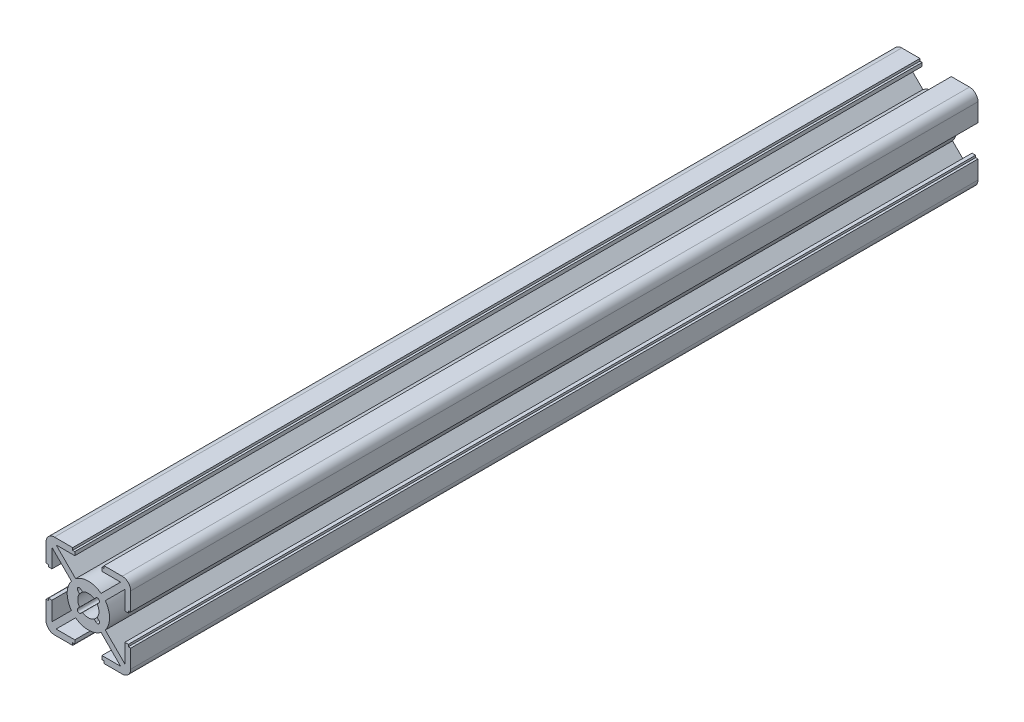
from build123d import *

# Parameters (mm, degrees)
Y_KSEKLIK_EKSTR_ZYON1_DEPTH = 200


with BuildPart() as part:
    # Çizim1 → Yükseklik-Ekstrüzyon1 (new body)
    with BuildSketch(Plane.XY):
        with BuildLine():
            Line((8.6, 7.610050506), (8.6, 3.2))
            Line((8.6, 3.2), (9.44, 3.2))
            Line((9.44, 3.2), (9.44, 3.7))
            Line((9.44, 3.7), (10, 3.7))
            Line((10, 3.7), (10, 8))
            ThreePointArc((10, 8), (9.414213562, 9.414213562), (8, 10))
            Line((8, 10), (3.7, 10))
            Line((3.7, 10), (3.7, 9.44))
            Line((3.7, 9.44), (3.2, 9.44))
            Line((3.2, 9.44), (3.2, 8.6))
            Line((3.2, 8.6), (7.610050506, 8.6))
            Line((7.610050506, 8.6), (3.005739466, 3.99568896))
            ThreePointArc((3.005739466, 3.99568896), (0, 5), (-3.005739466, 3.99568896))
            Line((-3.005739466, 3.99568896), (-7.610050506, 8.6))
            Line((-7.610050506, 8.6), (-3.2, 8.6))
            Line((-3.2, 8.6), (-3.2, 9.44))
            Line((-3.2, 9.44), (-3.7, 9.44))
            Line((-3.7, 9.44), (-3.7, 10))
            Line((-3.7, 10), (-8, 10))
            ThreePointArc((-8, 10), (-9.414213562, 9.414213562), (-10, 8))
            Line((-10, 8), (-10, 3.7))
            Line((-10, 3.7), (-9.44, 3.7))
            Line((-9.44, 3.7), (-9.44, 3.2))
            Line((-9.44, 3.2), (-8.6, 3.2))
            Line((-8.6, 3.2), (-8.6, 7.610050506))
            Line((-8.6, 7.610050506), (-3.99568896, 3.005739466))
            ThreePointArc((-3.99568896, 3.005739466), (-5, 0), (-3.99568896, -3.005739466))
            Line((-3.99568896, -3.005739466), (-8.6, -7.610050506))
            Line((-8.6, -7.610050506), (-8.6, -3.2))
            Line((-8.6, -3.2), (-9.44, -3.2))
            Line((-9.44, -3.2), (-9.44, -3.7))
            Line((-9.44, -3.7), (-10, -3.7))
            Line((-10, -3.7), (-10, -8))
            ThreePointArc((-10, -8), (-9.414213562, -9.414213562), (-8, -10))
            Line((-8, -10), (-3.7, -10))
            Line((-3.7, -10), (-3.7, -9.44))
            Line((-3.7, -9.44), (-3.2, -9.44))
            Line((-3.2, -9.44), (-3.2, -8.6))
            Line((-3.2, -8.6), (-7.610050506, -8.6))
            Line((-7.610050506, -8.6), (-3.005739466, -3.99568896))
            ThreePointArc((-3.005739466, -3.99568896), (0, -5), (3.005739466, -3.99568896))
            Line((3.005739466, -3.99568896), (7.610050506, -8.6))
            Line((7.610050506, -8.6), (3.2, -8.6))
            Line((3.2, -8.6), (3.2, -9.44))
            Line((3.2, -9.44), (3.7, -9.44))
            Line((3.7, -9.44), (3.7, -10))
            Line((3.7, -10), (8, -10))
            ThreePointArc((8, -10), (9.414213562, -9.414213562), (10, -8))
            Line((10, -8), (10, -3.7))
            Line((10, -3.7), (9.44, -3.7))
            Line((9.44, -3.7), (9.44, -3.2))
            Line((9.44, -3.2), (8.6, -3.2))
            Line((8.6, -3.2), (8.6, -7.610050506))
            Line((8.6, -7.610050506), (3.99568896, -3.005739466))
            ThreePointArc((3.99568896, -3.005739466), (5, 0), (3.99568896, 3.005739466))
            Line((3.99568896, 3.005739466), (8.6, 7.610050506))
        make_face()
        with BuildLine():
            Line((2.474873734, 1.767766953), (2.085604198, 1.378497417))
            ThreePointArc((2.085604198, 1.378497417), (2.5, 0), (2.085604198, -1.378497417))
            Line((2.085604198, -1.378497417), (2.474873734, -1.767766953))
            ThreePointArc((2.474873734, -1.767766953), (2.474873734, -2.474873734), (1.767766953, -2.474873734))
            Line((1.767766953, -2.474873734), (1.378497417, -2.085604198))
            ThreePointArc((1.378497417, -2.085604198), (0, -2.5), (-1.378497417, -2.085604198))
            Line((-1.378497417, -2.085604198), (-1.767766953, -2.474873734))
            ThreePointArc((-1.767766953, -2.474873734), (-2.474873734, -2.474873734), (-2.474873734, -1.767766953))
            Line((-2.474873734, -1.767766953), (-2.085604198, -1.378497417))
            ThreePointArc((-2.085604198, -1.378497417), (-2.5, 0), (-2.085604198, 1.378497417))
            Line((-2.085604198, 1.378497417), (-2.474873734, 1.767766953))
            ThreePointArc((-2.474873734, 1.767766953), (-2.474873734, 2.474873734), (-1.767766953, 2.474873734))
            Line((-1.767766953, 2.474873734), (-1.378497417, 2.085604198))
            ThreePointArc((-1.378497417, 2.085604198), (0, 2.5), (1.378497417, 2.085604198))
            Line((1.378497417, 2.085604198), (1.767766953, 2.474873734))
            ThreePointArc((1.767766953, 2.474873734), (2.474873734, 2.474873734), (2.474873734, 1.767766953))
        make_face(mode=Mode.SUBTRACT)
    extrude(amount=Y_KSEKLIK_EKSTR_ZYON1_DEPTH)


solid = part.part
